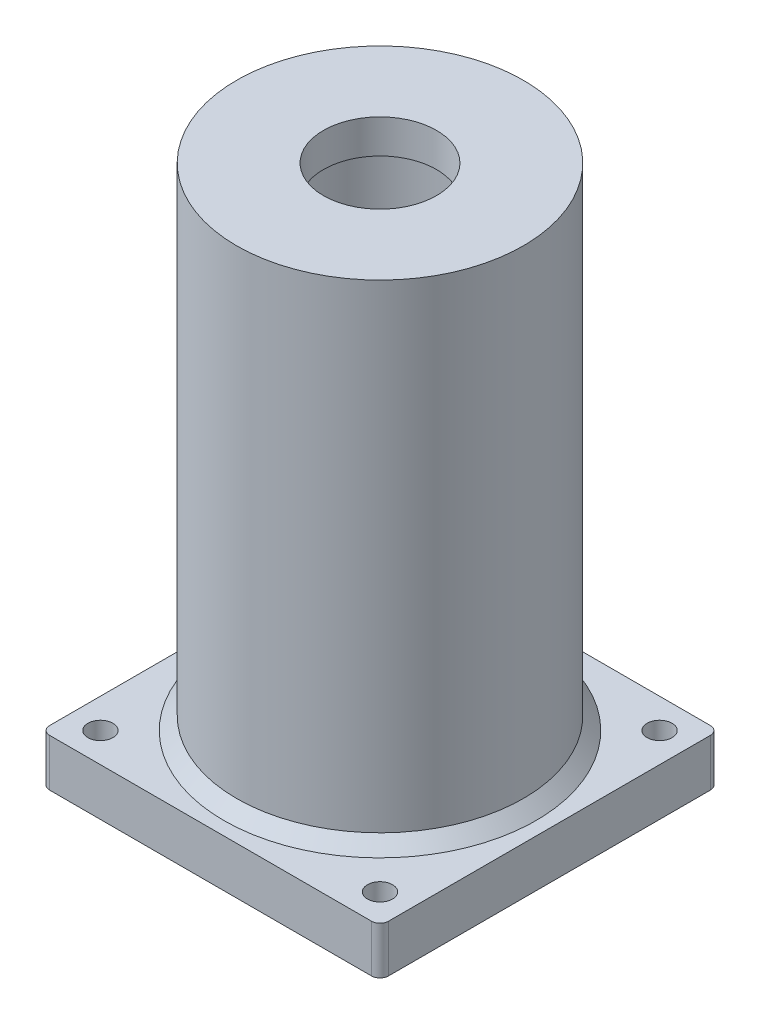
from build123d import *

# Parameters (mm, degrees)
SKETCH1_W           = 40
SKETCH1_H           = 40
BOSS_EXTRUDE1_DEPTH = 5.6
SKETCH2_R           = 16.925
SKETCH2_R_2         = 9.125
BOSS_EXTRUDE2_DEPTH = 54
SKETCH3_R           = 1.475
CUT_EXTRUDE1_DEPTH  = 10
FILLET1_R           = 1
CHAMFER1_SIZE       = 1.5
CUT_EXTRUDE2_START  = -10
SKETCH4_R           = 9.125
CUT_EXTRUDE2_DEPTH  = 10
SKETCH5_R           = 16.925
SKETCH5_R_2         = 6.675
BOSS_EXTRUDE3_DEPTH = 4


with BuildPart() as part:
    # Sketch1 → Boss-Extrude1 (new body)
    with BuildSketch(Plane(origin=(0, 0, 0), x_dir=(1, 0, 0), z_dir=(0, 1, 0))):
        Rectangle(SKETCH1_W, SKETCH1_H)
    extrude(amount=BOSS_EXTRUDE1_DEPTH)

    # Sketch2 → Boss-Extrude2 (add)
    with BuildSketch(Plane(origin=(0, 5.6, 0), x_dir=(1, 0, 0), z_dir=(0, 1, 0))):
        with Locations(Location((0, 0, 0), (0, 0, 270))):
            Circle(SKETCH2_R)
        with Locations(Location((0, 0, 0), (0, 0, 270))):
            Circle(SKETCH2_R_2, mode=Mode.SUBTRACT)
    extrude(amount=BOSS_EXTRUDE2_DEPTH)

    # Sketch3 → Cut-Extrude1 (cut)
    with BuildSketch(Plane.XZ):
        with Locations(Location((-16.5, -16.5, 0), (0, 0, 270))):
            Circle(SKETCH3_R)
        with Locations(Location((-16.5, 16.5, 0), (0, 0, 270))):
            Circle(SKETCH3_R)
        with Locations(Location((16.5, 16.5, 0), (0, 0, 270))):
            Circle(SKETCH3_R)
        with Locations(Location((16.5, -16.5, 0), (0, 0, 270))):
            Circle(SKETCH3_R)
    extrude(amount=-CUT_EXTRUDE1_DEPTH, mode=Mode.SUBTRACT)

    # Fillet1
    fillet1_edges = [part.edges().sort_by_distance(p)[0] for p in [
        (20, 2.8, 20),
        (-20, 2.8, 20),
        (-20, 2.8, -20),
        (20, 2.8, -20),
    ]]
    fillet(fillet1_edges, radius=FILLET1_R)

    # Chamfer1
    chamfer1_edges = [part.edges().sort_by_distance(p)[0] for p in [
        (0, 5.6, -16.925),
    ]]
    chamfer(chamfer1_edges, length=CHAMFER1_SIZE)

    # Sketch4 → Cut-Extrude2 (cut)
    with BuildSketch(Plane(origin=(0, 5.6, 0), x_dir=(1, 0, 0), z_dir=(0, 1, 0)).offset(CUT_EXTRUDE2_START)):
        with Locations(Location((0, 0, 0), (0, 0, 270))):
            Circle(SKETCH4_R)
    extrude(amount=CUT_EXTRUDE2_DEPTH, mode=Mode.SUBTRACT)

    # Sketch5 → Boss-Extrude3 (add)
    with BuildSketch(Plane(origin=(0, 59.6, 0), x_dir=(1, 0, 0), z_dir=(0, 1, 0))):
        with Locations(Location((0, 0, 0), (0, 0, 270))):
            Circle(SKETCH5_R)
        with Locations(Location((0, 0, 0), (0, 0, 270))):
            Circle(SKETCH5_R_2, mode=Mode.SUBTRACT)
    extrude(amount=BOSS_EXTRUDE3_DEPTH)


solid = part.part
